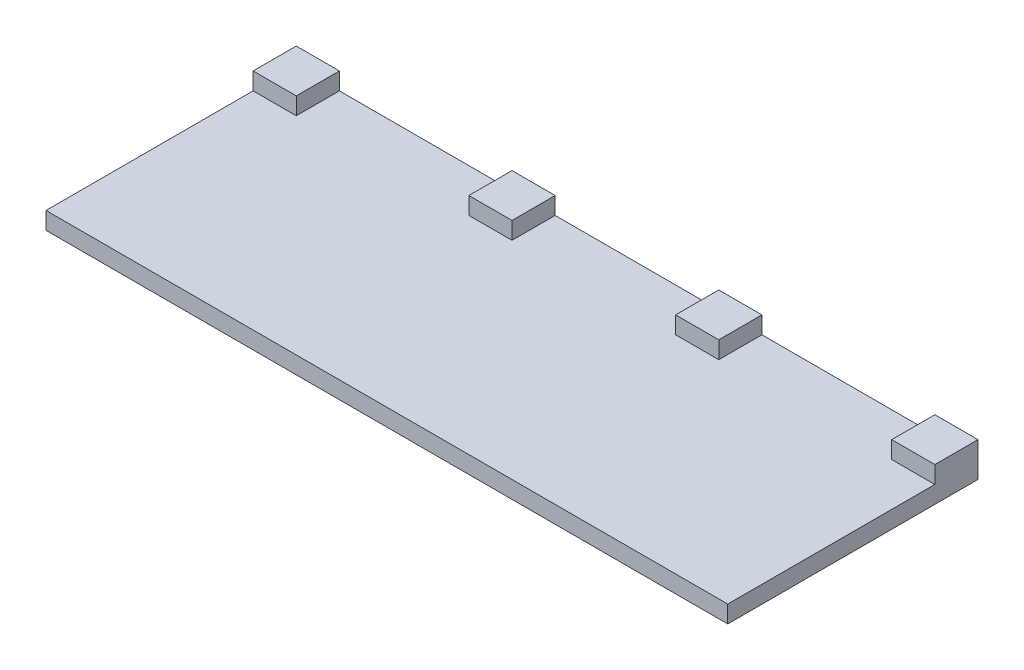
from build123d import *

# Parameters (mm, degrees)
SKETCH_1_W      = 79
SKETCH_1_H      = 29
EXTRUDE_1_DEPTH = 2
SKETCH_2_W      = 5
SKETCH_2_H      = 5
EXTRUDE_3_DEPTH = 4
SKETCH_3_W      = 5
SKETCH_3_H      = 5
EXTRUDE_4_DEPTH = 4


with BuildPart() as part:
    # 草图1 → 凸台-拉伸1 (new body)
    with BuildSketch(Plane(origin=(0, 0, 0), x_dir=(1, 0, 0), z_dir=(0, 1, 0))):
        with Locations((-57.963659684, 12.309109642)):
            Rectangle(SKETCH_1_W, SKETCH_1_H)
    extrude(amount=EXTRUDE_1_DEPTH)

    # 草图2 → 凸台-拉伸3 (add)
    with BuildSketch(Plane(origin=(0, 0, 0), x_dir=(1, 0, 0), z_dir=(0, 1, 0))):
        with Locations((-94.963659684, 24.309109642)):
            Rectangle(SKETCH_2_W, SKETCH_2_H)
        with Locations((-20.963659684, 24.309109642)):
            Rectangle(SKETCH_2_W, SKETCH_2_H)
    extrude(amount=EXTRUDE_3_DEPTH)

    # 草图3 → 凸台-拉伸4 (add)
    with BuildSketch(Plane(origin=(0, 0, 0), x_dir=(1, 0, 0), z_dir=(0, 1, 0))):
        with Locations((-69.963659684, 24.309109642)):
            Rectangle(SKETCH_3_W, SKETCH_3_H)
        with Locations((-46.003915764, 24.309109642)):
            Rectangle(SKETCH_3_W, SKETCH_3_H)
    extrude(amount=EXTRUDE_4_DEPTH)


solid = part.part
